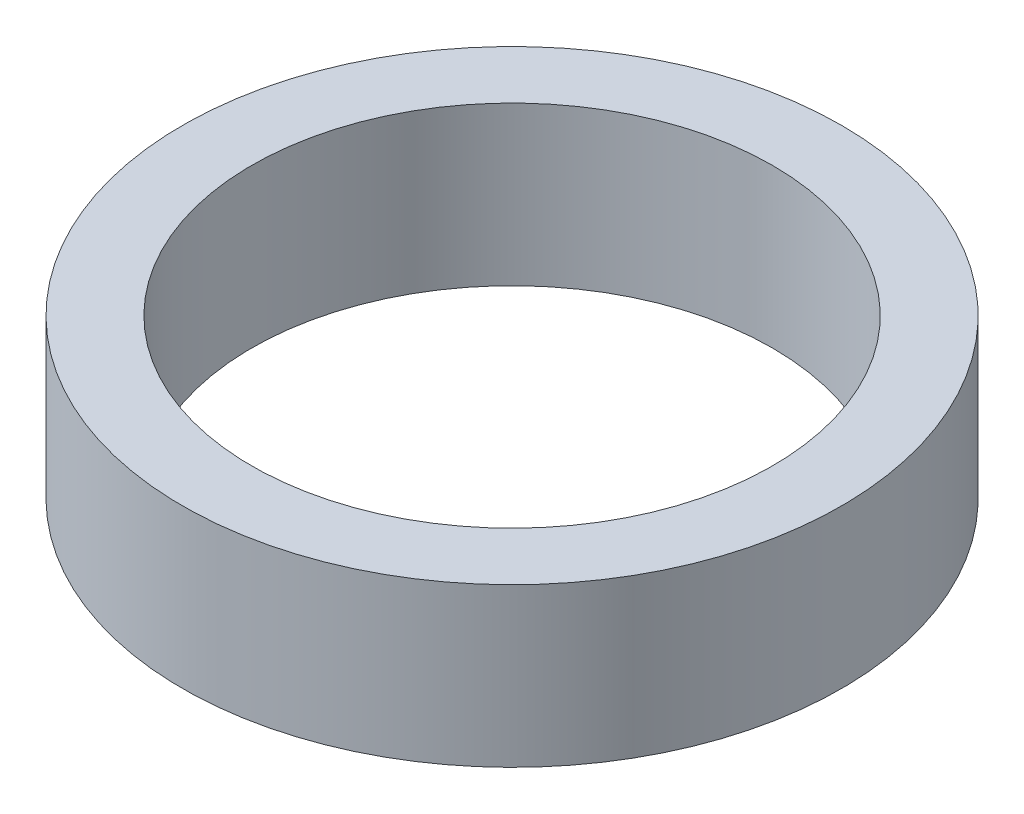
from build123d import *

# Parameters (mm, degrees)
SKETCH1_R           = 3.175
SKETCH1_R_2         = 2.50825
BOSS_EXTRUDE1_DEPTH = 1.524


with BuildPart() as part:
    # Sketch1 → Boss-Extrude1 (new body)
    with BuildSketch(Plane(origin=(0, 0, 0), x_dir=(1, 0, 0), z_dir=(0, 1, 0))):
        with Locations(Location((0, 0, 0), (0, 0, 90))):
            Circle(SKETCH1_R)
        with Locations(Location((0, 0, 0), (0, 0, 90))):
            Circle(SKETCH1_R_2, mode=Mode.SUBTRACT)
    extrude(amount=BOSS_EXTRUDE1_DEPTH)


solid = part.part
